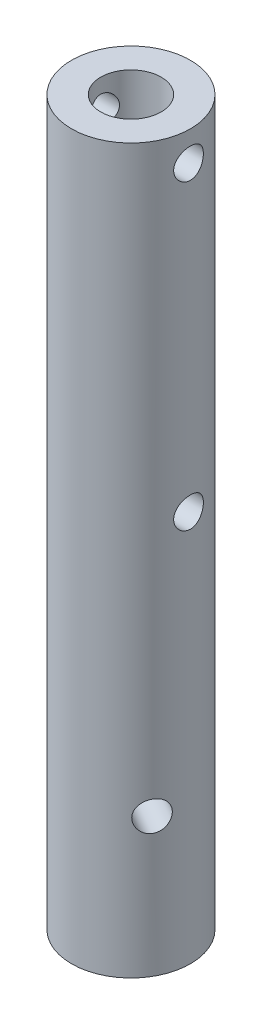
from build123d import *

# Parameters (mm, degrees)
TWELVE_MILLIMETRE_AXLE_STOCK_SKETCH_R = 6
TWELVE_MILLIMETRE_AXLE_STOCK_DEPTH    = 73
MOTOR_COUPLING_SOCKET_SKETCH_R        = 3.05
MOTOR_COUPLING_SOCKET_DEPTH           = 22.1
FRONT_COLLAR_PIN_SKETCH_R             = 1.5
FRONT_COLLAR_PIN_DEPTH                = 14
REAR_COLLAR_PIN_SKETCH_R              = 1.5
REAR_COLLAR_PIN_DEPTH                 = 14
HUB_DRIVE_PIN_SKETCH_R                = 1.5
HUB_DRIVE_PIN_DEPTH                   = 14


with BuildPart() as part:
    # Twelve millimetre axle stock sketch → Twelve millimetre axle stock (new body)
    with BuildSketch(Plane(origin=(0, -283, 0), x_dir=(1, 0, 0), z_dir=(0, 1, 0))):
        with Locations((-19.009182883, 53.244882879)):
            Circle(TWELVE_MILLIMETRE_AXLE_STOCK_SKETCH_R)
    extrude(amount=TWELVE_MILLIMETRE_AXLE_STOCK_DEPTH)

    # Motor coupling socket sketch → Motor coupling socket (cut)
    with BuildSketch(Plane(origin=(0, -232, 0), x_dir=(1, 0, 0), z_dir=(0, 1, 0))):
        with Locations((-19.009182883, 53.244882879)):
            Circle(MOTOR_COUPLING_SOCKET_SKETCH_R)
    extrude(amount=MOTOR_COUPLING_SOCKET_DEPTH, mode=Mode.SUBTRACT)

    # Front collar pin sketch → Front collar pin (cut)
    with BuildSketch(Plane(origin=(-26.009182883, 0, 0), x_dir=(0, 0, -1), z_dir=(1, 0, 0))):
        with Locations((53.244882879, -213)):
            Circle(FRONT_COLLAR_PIN_SKETCH_R)
    extrude(amount=FRONT_COLLAR_PIN_DEPTH, mode=Mode.SUBTRACT)

    # Rear collar pin sketch → Rear collar pin (cut)
    with BuildSketch(Plane(origin=(-26.009182883, 0, 0), x_dir=(0, 0, -1), z_dir=(1, 0, 0))):
        with Locations((53.244882879, -243.5)):
            Circle(REAR_COLLAR_PIN_SKETCH_R)
    extrude(amount=REAR_COLLAR_PIN_DEPTH, mode=Mode.SUBTRACT)

    # Hub drive pin sketch → Hub drive pin (cut)
    with BuildSketch(Plane(origin=(-43.374775586, 0, -25.042438361), x_dir=(0.5000000000000001, 0, -0.8660254037844386), z_dir=(0.8660254037844386, 0, 0.5000000000000001))):
        with Locations((36.606829753, -269)):
            Circle(HUB_DRIVE_PIN_SKETCH_R)
    extrude(amount=HUB_DRIVE_PIN_DEPTH, mode=Mode.SUBTRACT)


solid = part.part
